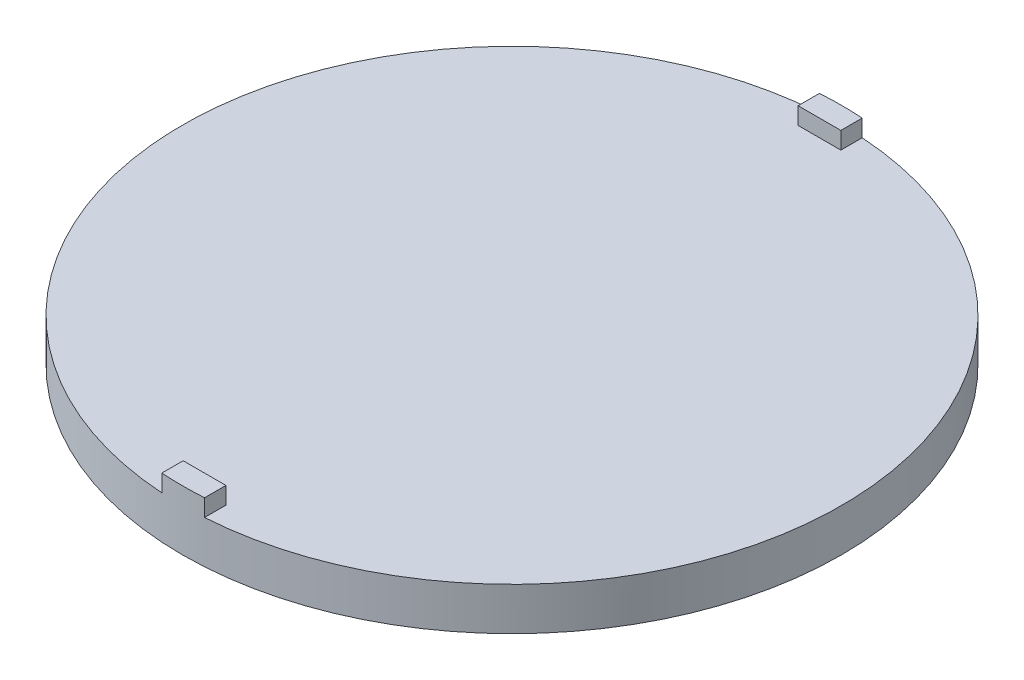
from build123d import *

# Parameters (mm, degrees)
SKETCH1_R           = 24.477436685
BOSS_EXTRUDE1_DEPTH = 3.175
BOSS_EXTRUDE2_START = 1.27
BOSS_EXTRUDE2_DEPTH = 1.27


with BuildPart() as part:
    # Sketch1 → Boss-Extrude1 (new body)
    with BuildSketch(Plane.XZ):
        Circle(SKETCH1_R)
    extrude(amount=BOSS_EXTRUDE1_DEPTH)

    # Sketch2 → Boss-Extrude2 (add)
    with BuildSketch(Plane(origin=(0, 0, 0), x_dir=(1, 0, 0), z_dir=(0, 1, 0)).offset(BOSS_EXTRUDE2_START)):
        with BuildLine():
            Line((1.5875, 24.425903267), (1.5875, 22.838403267))
            Line((1.5875, 22.838403267), (-1.5875, 22.838403267))
            Line((-1.5875, 22.838403267), (-1.5875, 24.425903267))
            ThreePointArc((-1.5875, 24.425903267), (0, 24.477436685), (1.5875, 24.425903267))
        make_face()
        with BuildLine():
            Line((-1.5875, -24.425903267), (-1.5875, -22.838403267))
            Line((-1.5875, -22.838403267), (1.5875, -22.838403267))
            Line((1.5875, -22.838403267), (1.5875, -24.425903267))
            ThreePointArc((1.5875, -24.425903267), (0, -24.477436685), (-1.5875, -24.425903267))
        make_face()
    extrude(amount=-BOSS_EXTRUDE2_DEPTH)


solid = part.part
